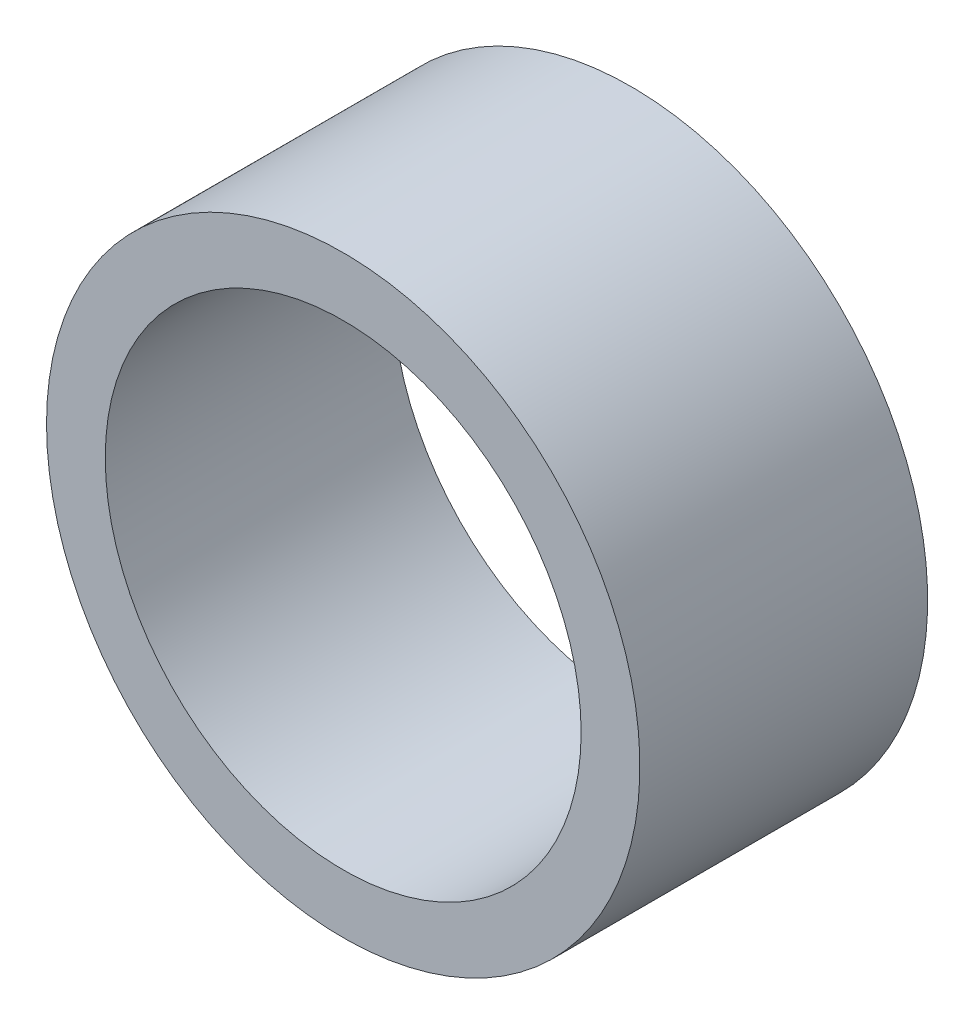
from build123d import *

# Parameters (mm, degrees)
SKETCH_1_R      = 25
SKETCH_1_R_2    = 20.05
EXTRUDE_1_DEPTH = 24.25


with BuildPart() as part:
    # ｽｹｯﾁ1 → ﾎﾞｽ - 押し出し1 (new body)
    with BuildSketch(Plane.XY):
        with Locations(Location((0, 0, 0), (0, 0, 180))):
            Circle(SKETCH_1_R)
        with Locations(Location((0, 0, 0), (0, 0, 180))):
            Circle(SKETCH_1_R_2, mode=Mode.SUBTRACT)
    extrude(amount=EXTRUDE_1_DEPTH)


solid = part.part
